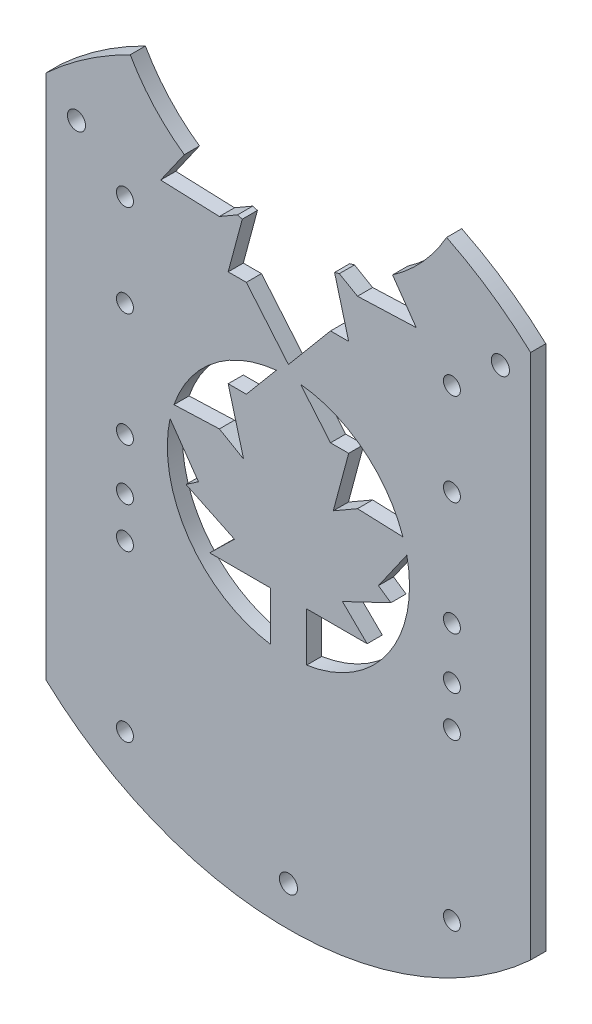
from build123d import *

# Parameters (mm, degrees)
SKETCH1_R           = 1.89865
BOSS_EXTRUDE3_DEPTH = 3.175
CUT_EXTRUDE2_DEPTH  = 3.175
SKETCH4_R           = 1.778
CUT_EXTRUDE3_DEPTH  = 3.175
SKETCH5_R           = 1.778
CUT_EXTRUDE4_DEPTH  = 3.175
CUT_EXTRUDE5_DEPTH  = 3.175


with BuildPart() as part:
    # Sketch1 → Boss-Extrude3 (new body)
    with BuildSketch(Plane.XY):
        with BuildLine():
            Line((-50.8, 55.175719298), (-50.8, -55.175719298))
            ThreePointArc((-50.8, -55.175719298), (0, -75), (50.8, -55.175719298))
            Line((50.8, -55.175719298), (50.8, 55.175719298))
            ThreePointArc((50.8, 55.175719298), (42.419210034, 61.851520758), (33.172661219, 67.264957799))
            ThreePointArc((33.172661219, 67.264957799), (0, 47.904876359), (-33.172661219, 67.264957799))
            ThreePointArc((-33.172661219, 67.264957799), (-42.419210034, 61.851520758), (-50.8, 55.175719298))
        make_face()
        with Locations((0, -66.675)):
            Circle(SKETCH1_R, mode=Mode.SUBTRACT)
        with Locations((-44.45, 49.6966108)):
            Circle(SKETCH1_R, mode=Mode.SUBTRACT)
        with Locations(Location((44.45, 49.6966108, 0), (0, 0, 180))):
            Circle(SKETCH1_R, mode=Mode.SUBTRACT)
    extrude(amount=BOSS_EXTRUDE3_DEPTH)

    # Sketch3 → Cut-Extrude2 (cut)
    with BuildSketch(Plane.XY.offset(3.175)):
        with BuildLine():
            Line((8.827105782, 17.78), (2.54, 25.272680903))
            ThreePointArc((2.54, 25.272680903), (15.758317518, 19.920728626), (24.009298775, 8.289365013))
            Line((24.009298775, 8.289365013), (14.484298775, 8.647939367))
            Line((14.484298775, 8.647939367), (9.404298775, 5.715))
            Line((9.404298775, 5.715), (12.637105782, 17.78))
            Line((12.637105782, 17.78), (8.827105782, 17.78))
        make_face()
        with BuildLine():
            Line((18.868143133, -3.140634987), (24.826209076, 5.368365013))
            ThreePointArc((24.826209076, 5.368365013), (20.911260009, -14.418016674), (3.81, -25.112624315))
            Line((3.81, -25.112624315), (3.81, -14.877877919))
            Line((3.81, -14.877877919), (16.51, -14.877877919))
            Line((16.51, -14.877877919), (11.327081569, -9.797877919))
            Line((11.327081569, -9.797877919), (21.487081569, -4.935568543))
            Line((21.487081569, -4.935568543), (18.868143133, -3.140634987))
        make_face()
        with BuildLine():
            Line((-3.81, -14.877877919), (-3.81, -25.112624315))
            ThreePointArc((-3.81, -25.112624315), (-20.911260009, -14.418016674), (-24.826209076, 5.368365013))
            Line((-24.826209076, 5.368365013), (-18.868143133, -3.140634987))
            Line((-18.868143133, -3.140634987), (-21.487081569, -4.935568543))
            Line((-21.487081569, -4.935568543), (-11.327081569, -9.797877919))
            Line((-11.327081569, -9.797877919), (-16.51, -14.877877919))
            Line((-16.51, -14.877877919), (-3.81, -14.877877919))
        make_face()
        with BuildLine():
            Line((-14.484298775, 8.647939367), (-24.009298775, 8.289365013))
            ThreePointArc((-24.009298775, 8.289365013), (-15.758317518, 19.920728626), (-2.54, 25.272680903))
            Line((-2.54, 25.272680903), (-8.827105782, 17.78))
            Line((-8.827105782, 17.78), (-12.637105782, 17.78))
            Line((-12.637105782, 17.78), (-9.404298775, 5.715))
            Line((-9.404298775, 5.715), (-14.484298775, 8.647939367))
        make_face()
    extrude(amount=-CUT_EXTRUDE2_DEPTH, mode=Mode.SUBTRACT)

    # Sketch4 → Cut-Extrude3 (cut)
    with BuildSketch(Plane.XY.offset(3.175)):
        with Locations((-34.29, 40.919876359)):
            Circle(SKETCH4_R)
        with Locations((34.29, 40.919876359)):
            Circle(SKETCH4_R)
        with Locations((34.29, -2.260123641)):
            Circle(SKETCH4_R)
        with Locations((-34.29, -2.260123641)):
            Circle(SKETCH4_R)
        with Locations((-34.29, -13.055123641)):
            Circle(SKETCH4_R)
        with Locations((34.29, -13.055123641)):
            Circle(SKETCH4_R)
        with Locations((34.29, -56.235123641)):
            Circle(SKETCH4_R)
        with Locations((-34.29, -56.235123641)):
            Circle(SKETCH4_R)
    extrude(amount=-CUT_EXTRUDE3_DEPTH, mode=Mode.SUBTRACT)

    # Sketch5 → Cut-Extrude4 (cut)
    with BuildSketch(Plane.XY.offset(3.175)):
        with Locations((-34.29, 21.59)):
            Circle(SKETCH5_R)
        with Locations((34.29, 21.59)):
            Circle(SKETCH5_R)
        with Locations((34.29, -21.59)):
            Circle(SKETCH5_R)
        with Locations((-34.29, -21.59)):
            Circle(SKETCH5_R)
    extrude(amount=-CUT_EXTRUDE4_DEPTH, mode=Mode.SUBTRACT)

    # Sketch6 → Cut-Extrude5 (cut)
    with BuildSketch(Plane.XY.offset(3.175)):
        Polygon((-8.827105782, 38.1), (-2.54, 30.607319097), (0, 27.580264972), (2.54, 30.607319097), (8.827105782, 38.1), (12.637105782, 38.1), (9.404298775, 50.165), (14.484298775, 47.232060633), (24.009298775, 47.590634987), (26.798005722, 47.695617537), (24.826209076, 50.511634987), (18.868143133, 59.020634987), (-18.868143133, 59.020634987), (-24.826209076, 50.511634987), (-26.798005722, 47.695617537), (-24.009298775, 47.590634987), (-14.484298775, 47.232060633), (-9.404298775, 50.165), (-12.637105782, 38.1), align=None)
    extrude(amount=-CUT_EXTRUDE5_DEPTH, mode=Mode.SUBTRACT)


solid = part.part
